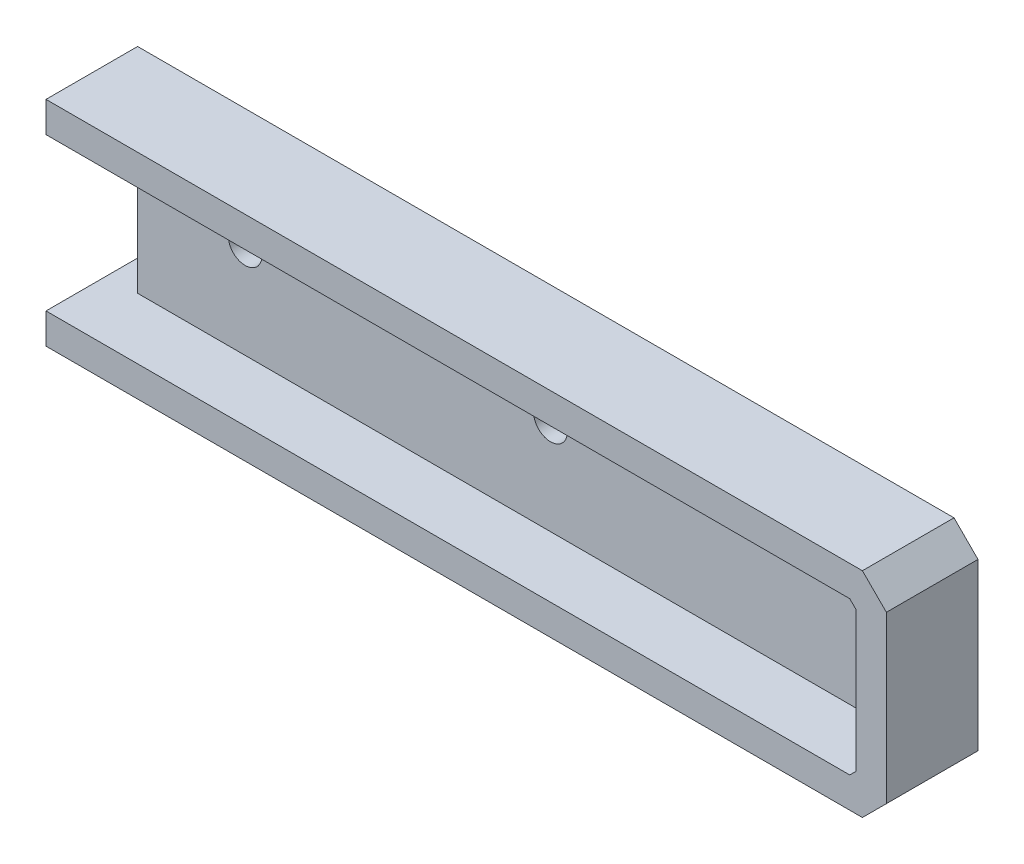
from build123d import *

# Parameters (mm, degrees)
SKETCH1_R           = 2.75
BOSS_EXTRUDE1_DEPTH = 5
BOSS_EXTRUDE4_DEPTH = 15


with BuildPart() as part:
    # Sketch1 → Boss-Extrude1 (new body)
    with BuildSketch(Plane.XY):
        Polygon((72.390908062, 0), (72.390908062, -25), (195, -25), (199, -25), (200, -24), (200, -1), (199, 0), (195, 0), align=None)
        with Locations(Location((90, -9.5, 0), (0, 0, 180))):
            Circle(SKETCH1_R, mode=Mode.SUBTRACT)
        with Locations(Location((140, -9.5, 0), (0, 0, 180))):
            Circle(SKETCH1_R, mode=Mode.SUBTRACT)
    extrude(amount=BOSS_EXTRUDE1_DEPTH)

    # Sketch2 → Boss-Extrude4 (add)
    with BuildSketch(Plane(origin=(0, 0, 0), x_dir=(-1, 0, 0), z_dir=(0, 0, -1))):
        Polygon((-72.390908062, 0), (-199, 0), (-200, -1), (-200, -24), (-199, -25), (-72.390908062, -25), (-67.390908062, -25), (-67.390908062, -30), (-201.071067812, -30), (-205, -26.071067812), (-205, 1.071067812), (-201.071067812, 5), (-67.390908062, 5), (-67.390908062, 0), align=None)
    extrude(amount=-BOSS_EXTRUDE4_DEPTH)


solid = part.part
